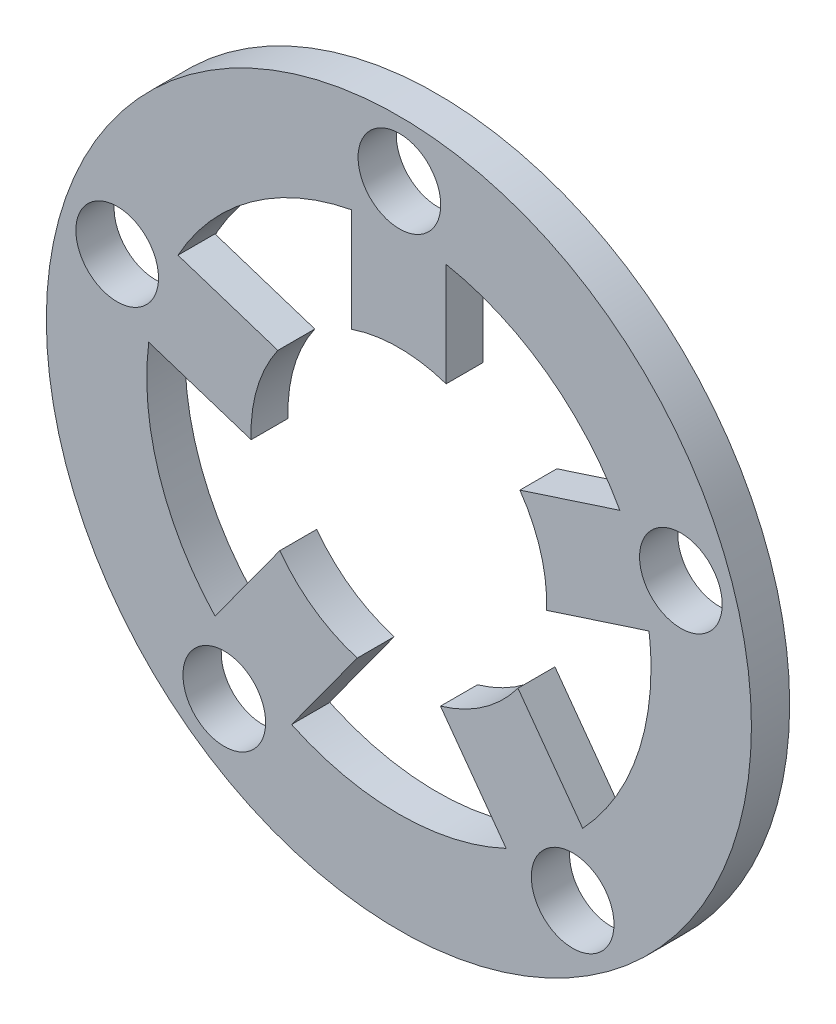
from build123d import *

# Parameters (mm, degrees)
RING_DEPTH              = 2.653567955
RING_DEPTH_BACK         = 0.508
SKETCH2_R               = 29.138416471
SKETCH2_R_2             = 20.83618439
TEETH_START             = -0.401310706
SKETCH4_W               = 7.816761814
SKETCH4_H               = 9.871955338
TEETH_DEPTH             = 3.054878706
CIRPATTERN1_COUNT       = 5
SKETCH6_R               = 3.416225964
CUT_EXTRUDE1_DEPTH      = 8.89
CIRPATTERN2_COUNT       = 5
CUT_EXTRUDE3_DEPTH      = 7.874
CUT_EXTRUDE3_DEPTH_BACK = 5.08
SKETCH7_R               = 12.218567197


with BuildPart() as part:
    # Sketch2 → Ring (new, two sides: drawn at the far end of the back side and taken through both)
    with BuildSketch(Plane.XY.offset(-RING_DEPTH_BACK)):
        Circle(SKETCH2_R)
        Circle(SKETCH2_R_2, mode=Mode.SUBTRACT)
    extrude(amount=RING_DEPTH + RING_DEPTH_BACK)

    # Sketch4 → Teeth (add)
    with BuildSketch(Plane.XY.offset(TEETH_START)):
        with Locations((0, 15.900206721)):
            Rectangle(SKETCH4_W, SKETCH4_H)
    teeth = extrude(amount=TEETH_DEPTH)

    # CirPattern1: Teeth ×5 about axis
    cirpattern1_axis = Axis((0, 0, 0), (0, 0, 1))
    for i in range(1, CIRPATTERN1_COUNT):
        add(teeth.rotate(cirpattern1_axis, i * 360 / CIRPATTERN1_COUNT))

    # Sketch6 → Cut-Extrude1 (cut)
    with BuildSketch(Plane(origin=(0, 0, -0.508), x_dir=(-1, 0, 0), z_dir=(0, 0, -1))):
        with Locations((-23.307220113, 7.528711947)):
            Circle(SKETCH6_R)
    cut_extrude1 = extrude(amount=-CUT_EXTRUDE1_DEPTH, mode=Mode.SUBTRACT)

    # CirPattern2: Cut-Extrude1 ×5 about axis
    cirpattern2_axis = Axis((0, 0, 0), (0, 0, 1))
    for i in range(1, CIRPATTERN2_COUNT):
        add(cut_extrude1.rotate(cirpattern2_axis, i * 360 / CIRPATTERN2_COUNT), mode=Mode.SUBTRACT)

    # Sketch7 → Cut-Extrude3 (cut, two sides: drawn at the far end of the back side and taken through both)
    with BuildSketch(Plane.XY.offset(-CUT_EXTRUDE3_DEPTH_BACK)):
        with Locations((0, 0.340402239)):
            Circle(SKETCH7_R)
    extrude(amount=CUT_EXTRUDE3_DEPTH + CUT_EXTRUDE3_DEPTH_BACK, mode=Mode.SUBTRACT)


solid = part.part
